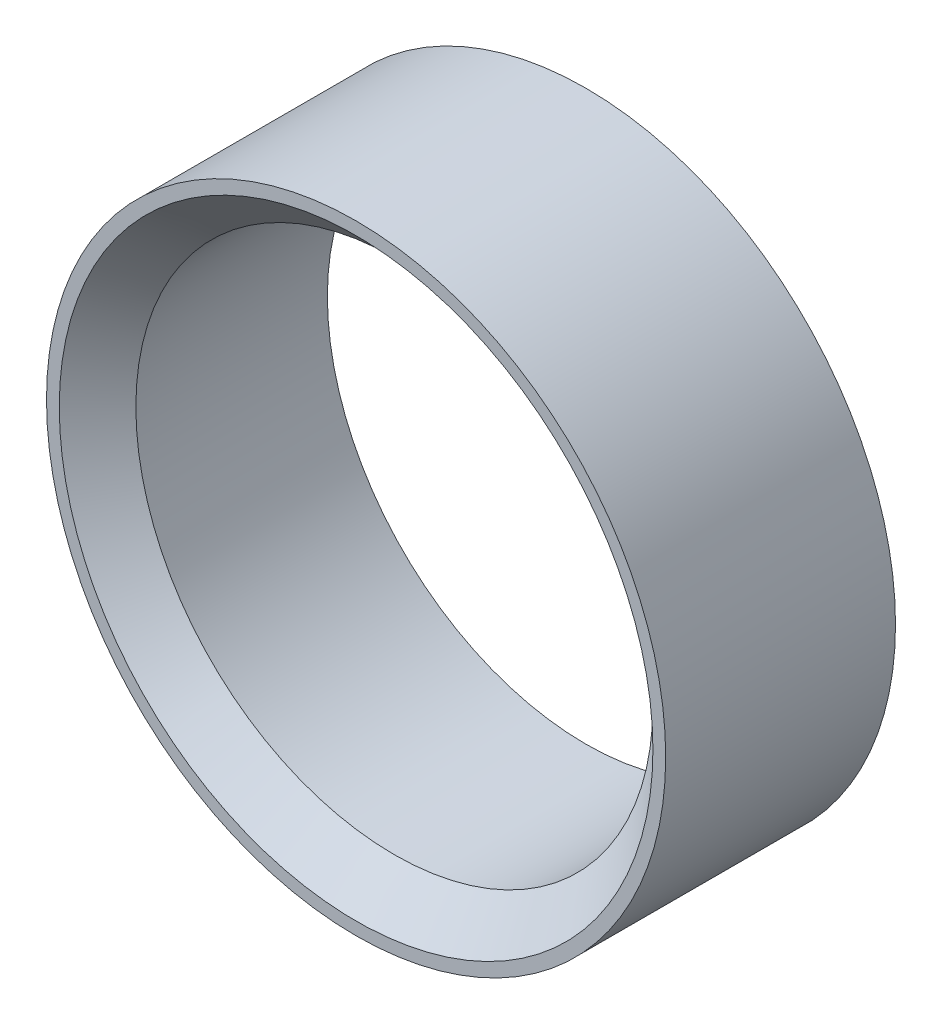
from build123d import *

# Parameters (mm, degrees)
ESQUISSE1_R             = 24.25
ESQUISSE1_R_2           = 20.25
BOSS_EXTRU_1_DEPTH      = 48
CHANFREIN1_SIZE         = 3
ESQUISSE2_R             = 24.25
ENL_V_MAT_EXTRU_1_DEPTH = 30


with BuildPart() as part:
    # Esquisse1 → Boss.-Extru.1 (new body)
    with BuildSketch(Plane.XY):
        Circle(ESQUISSE1_R)
        Circle(ESQUISSE1_R_2, mode=Mode.SUBTRACT)
    extrude(amount=BOSS_EXTRU_1_DEPTH)

    # Chanfrein1
    chanfrein1_edges = [part.edges().sort_by_distance(p)[0] for p in [
        (-20.25, 0, 48),
    ]]
    chamfer(chanfrein1_edges, length=CHANFREIN1_SIZE)

    # Esquisse2 → Enlèv. mat.-Extru.1 (cut)
    with BuildSketch(Plane(origin=(0, 0, 0), x_dir=(-1, 0, 0), z_dir=(0, 0, -1))):
        Circle(ESQUISSE2_R)
    extrude(amount=-ENL_V_MAT_EXTRU_1_DEPTH, mode=Mode.SUBTRACT)


solid = part.part
